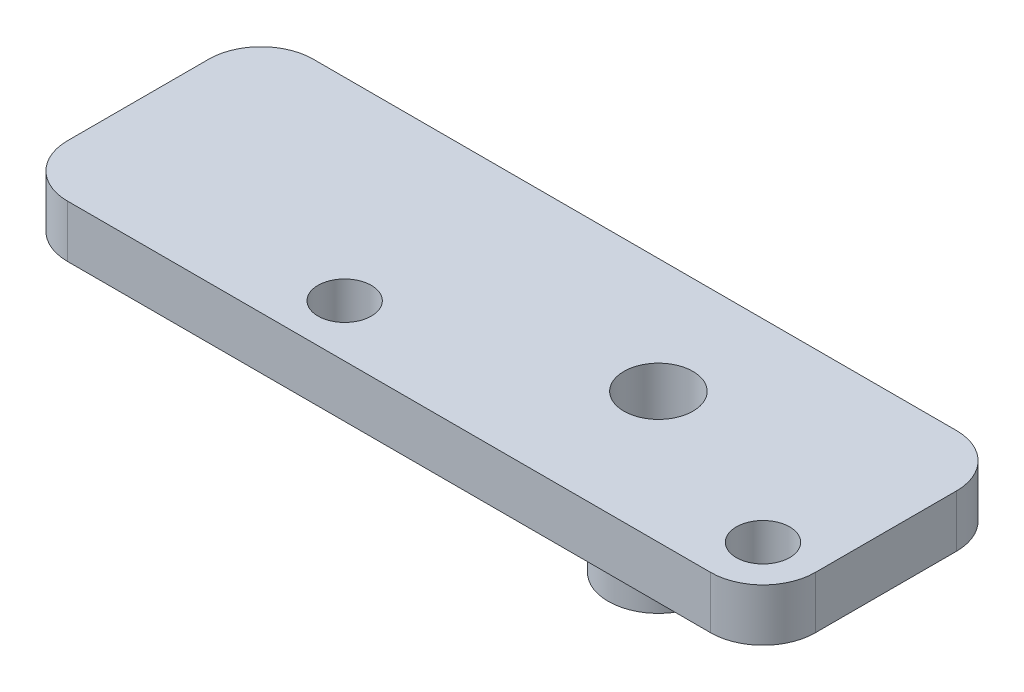
from build123d import *
from build123d.topology import SkipClean

# Parameters (mm, degrees)
SKETCH1_W           = 143
SKETCH1_H           = 47
SKETCH1_R           = 6.6
SKETCH1_R_2         = 5.1
BOSS_EXTRUDE1_DEPTH = 10
FILLET1_R           = 10
FILLET2_R           = 10
FILLET3_R           = 10
FILLET4_R           = 10
BOSS_EXTRUDE2_START = 20
SKETCH2_R           = 9.6
SKETCH2_R_2         = 6.6
BOSS_EXTRUDE2_DEPTH = 20


with BuildPart() as part:
    # Sketch1 → Boss-Extrude1 (new body)
    with BuildSketch(Plane(origin=(0, 0, 0), x_dir=(1, 0, 0), z_dir=(0, 1, 0))):
        with Locations((-26.5, -1.5)):
            Rectangle(SKETCH1_W, SKETCH1_H)
        with Locations(Location((0, 0, 0), (0, 0, 270))):
            Circle(SKETCH1_R, mode=Mode.SUBTRACT)
        with Locations(Location((-45, -15, 0), (0, 0, 270))):
            Circle(SKETCH1_R_2, mode=Mode.SUBTRACT)
        with Locations(Location((35, -15, 0), (0, 0, 270))):
            Circle(SKETCH1_R_2, mode=Mode.SUBTRACT)
    extrude(amount=BOSS_EXTRUDE1_DEPTH)

    # Fillet1
    fillet1_edges = [part.edges().sort_by_distance(p)[0] for p in [
        (-98, 5, -22),
    ]]
    fillet(fillet1_edges, radius=FILLET1_R)

    # Fillet2
    fillet2_edges = [part.edges().sort_by_distance(p)[0] for p in [
        (-98, 5, 25),
    ]]
    fillet(fillet2_edges, radius=FILLET2_R)

    # Fillet3
    fillet3_edges = [part.edges().sort_by_distance(p)[0] for p in [
        (45, 5, 25),
    ]]
    fillet(fillet3_edges, radius=FILLET3_R)

    # Fillet4
    fillet4_edges = [part.edges().sort_by_distance(p)[0] for p in [
        (45, 5, -22),
    ]]
    fillet(fillet4_edges, radius=FILLET4_R)

    # Sketch2 → Boss-Extrude2 (add)
    with SkipClean():  # the faces are left unmerged after this step: merging them gives an invalid solid
        with BuildSketch(Plane.XZ.offset(BOSS_EXTRUDE2_START)):
            with Locations(Location((0, 0, 0), (0, 0, 90))):
                Circle(SKETCH2_R)
            with Locations(Location((0, 0, 0), (0, 0, 270))):
                Circle(SKETCH2_R_2, mode=Mode.SUBTRACT)
        extrude(amount=-BOSS_EXTRUDE2_DEPTH)


solid = part.part
